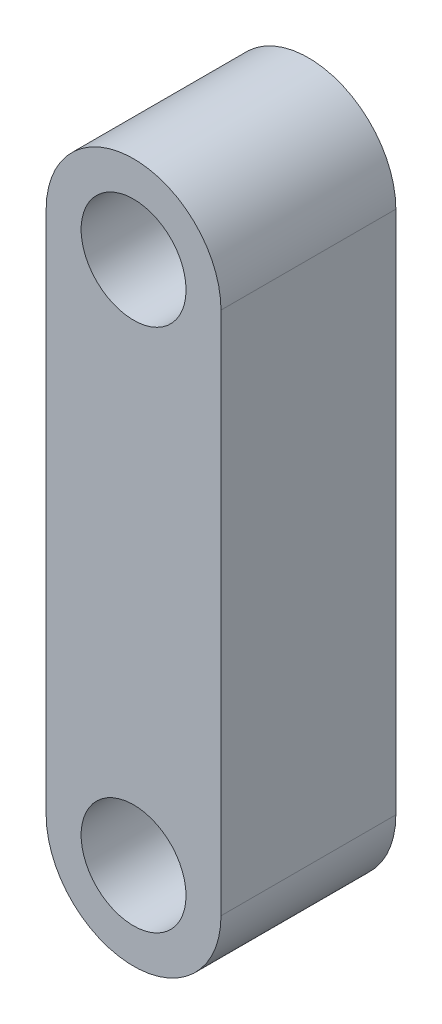
from build123d import *

# Parameters (mm, degrees)
BOSS_EXTRUDE1_DEPTH = 5


with BuildPart() as part:
    # Sketch1 → Boss-Extrude1 (new body)
    with BuildSketch(Plane.XY):
        with BuildLine():
            ThreePointArc((-2.5, 15), (0, 12.5), (2.5, 15))
            Line((2.5, 15), (1.5, 15))
            ThreePointArc((1.5, 15), (0, 13.5), (-1.5, 15))
            Line((-1.5, 15), (-2.5, 15))
        make_face()
        with BuildLine():
            Line((1.5, 15), (2.5, 15))
            ThreePointArc((2.5, 15), (0, 17.5), (-2.5, 15))
            Line((-2.5, 15), (-1.5, 15))
            ThreePointArc((-1.5, 15), (0, 16.5), (1.5, 15))
        make_face()
        with BuildLine():
            ThreePointArc((-2.5, 0), (0, 2.5), (2.5, 0))
            Line((2.5, 0), (2.5, 15))
            ThreePointArc((2.5, 15), (0, 12.5), (-2.5, 15))
            Line((-2.5, 15), (-2.5, 0))
        make_face()
        with BuildLine():
            ThreePointArc((-1.5, 0), (0, 1.5), (1.5, 0))
            Line((1.5, 0), (2.5, 0))
            ThreePointArc((2.5, 0), (0, 2.5), (-2.5, 0))
            Line((-2.5, 0), (-1.5, 0))
        make_face()
        with BuildLine():
            Line((2.5, 0), (1.5, 0))
            ThreePointArc((1.5, 0), (0, -1.5), (-1.5, 0))
            Line((-1.5, 0), (-2.5, 0))
            ThreePointArc((-2.5, 0), (0, -2.5), (2.5, 0))
        make_face()
    extrude(amount=BOSS_EXTRUDE1_DEPTH)


solid = part.part
